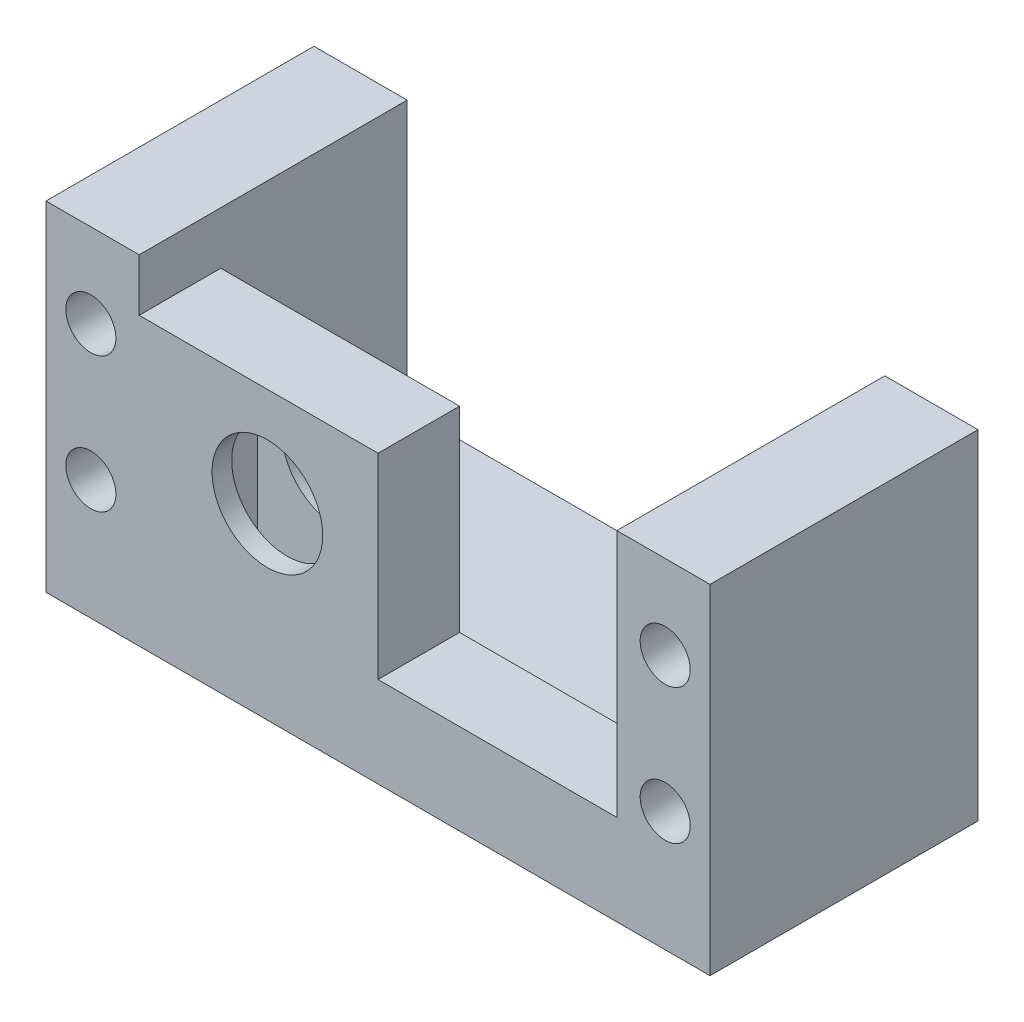
from build123d import *

# Parameters (mm, degrees)
EXTRUDE_1_DEPTH     = 23
SKETCH_5_R          = 2.7
SKETCH_5_R_2        = 4.75
EXTRUDE_6_DEPTH     = 7
SKETCH_6_R          = 2.15
CUT_EXTRUDE_2_DEPTH = 78.35709986
SKETCH_8_W          = 20.5
SKETCH_8_H          = 16.823085553
CUT_EXTRUDE_4_DEPTH = 7
SKETCH_14_W         = 13.6
SKETCH_14_H         = 4.3
CUT_EXTRUDE_7_DEPTH = 22.74


with BuildPart() as part:
    # Эскиз1 → Бобышка-Вытянуть1 (new body)
    with BuildSketch(Plane.XY):
        Polygon((-59.190561798, -40.176897727), (-59.190561798, -15.085730337), (-51.190561798, -15.085730337), (-51.190561798, -38.085730337), (-10.190561798, -38.085730337), (-10.190561798, -15.085730337), (-2.190561798, -15.085730337), (-2.190561798, -38.085730337), (-2.190561798, -44.176897727), (-59.190561798, -44.176897727), align=None)
    extrude(amount=EXTRUDE_1_DEPTH)

    # Эскиз5 → Бобышка-Вытянуть6 (add)
    with BuildSketch(Plane.XY.offset(23)):
        Polygon((-21.190561798, -19.58573034), (-51.190561798, -19.58573034), (-51.190561798, -34.983929743), (-51.190561798, -38.085730337), (-10.190561798, -38.085730337), (-10.190561798, -34.983929743), (-10.190561798, -19.58573034), align=None)
        with Locations((-21.190561798, -28.085730337)):
            Circle(SKETCH_5_R, mode=Mode.SUBTRACT)
        with Locations(Location((-40.190561798, -28.085730337, 0), (0, 0, 180))):
            Circle(SKETCH_5_R_2, mode=Mode.SUBTRACT)
    extrude(amount=-EXTRUDE_6_DEPTH)

    # Эскиз6 → Вырез-Вытянуть2 (cut, through all)
    with BuildSketch(Plane.XY.offset(23)):
        with Locations((-6.040561798, -33.885730337)):
            Circle(SKETCH_6_R)
        with Locations((-6.040561798, -22.285730337)):
            Circle(SKETCH_6_R)
        with Locations((-55.340561798, -33.885730337)):
            Circle(SKETCH_6_R)
        with Locations((-55.340561798, -22.285730337)):
            Circle(SKETCH_6_R)
    extrude(amount=-CUT_EXTRUDE_2_DEPTH, mode=Mode.SUBTRACT)

    # Эскиз8 → Вырез-Вытянуть4 (cut)
    with BuildSketch(Plane.XY.offset(23)):
        with Locations((-20.440561798, -27.997273117)):
            Rectangle(SKETCH_8_W, SKETCH_8_H)
    extrude(amount=-CUT_EXTRUDE_4_DEPTH, mode=Mode.SUBTRACT)

    # Эскиз14 → Вырез-Вытянуть7 (cut)
    with BuildSketch(Plane(origin=(0, -44.176897727, 0), x_dir=(-1, 0, 0), z_dir=(0, -1, 0))):
        with Locations((40.227814592, -19.162885498)):
            Rectangle(SKETCH_14_W, SKETCH_14_H)
    extrude(amount=-CUT_EXTRUDE_7_DEPTH, mode=Mode.SUBTRACT)


solid = part.part
